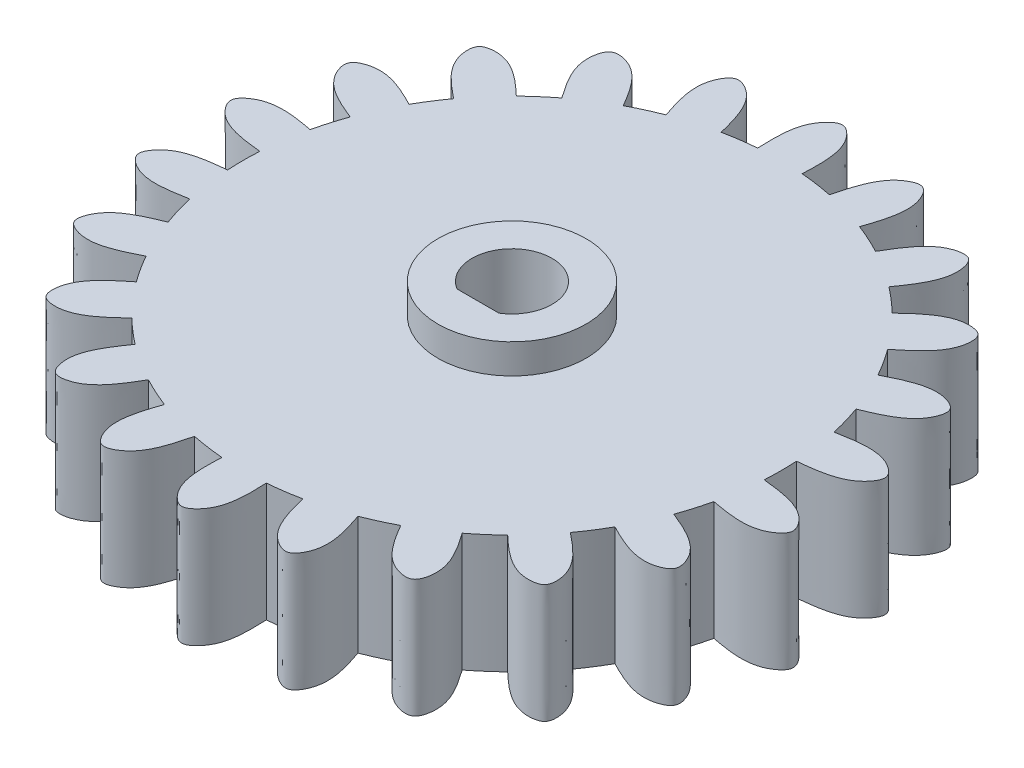
from build123d import *

# Parameters (mm, degrees)
SKETCH1_R           = 18.145
BOSS_EXTRUDE1_DEPTH = 10
SKETCH2_R           = 5
BOSS_EXTRUDE2_DEPTH = 2
BOSS_EXTRUDE5_DEPTH = 10
CIRPATTERN1_COUNT   = 22
CUT_EXTRUDE1_DEPTH  = 34.593002308
SKETCH6_R           = 36.478702283
CUT_EXTRUDE2_DEPTH  = 2


with BuildPart() as part:
    # Sketch1 → Boss-Extrude1 (new body)
    with BuildSketch(Plane(origin=(0, 0, 0), x_dir=(1, 0, 0), z_dir=(0, 1, 0))):
        with Locations(Location((0, 0, 0), (0, 0, 270))):
            Circle(SKETCH1_R)
    extrude(amount=BOSS_EXTRUDE1_DEPTH)

    # Sketch2 → Boss-Extrude2 (add)
    with BuildSketch(Plane(origin=(0, 10, 0), x_dir=(1, 0, 0), z_dir=(0, 1, 0))):
        with Locations(Location((0, 0, 0), (0, 0, 270))):
            Circle(SKETCH2_R)
    extrude(amount=BOSS_EXTRUDE2_DEPTH)

    # Sketch4 → Boss-Extrude5 (add)
    with BuildSketch(Plane.XZ):
        with BuildLine():
            Line((-1.5, -18.082893159), (1.5, -18.082893159))
            add(Edge.make_bspline(
                [(1.5, -18.082893159), (1.52233311, -18.648098407), (1.574363817, -19.964888924), (1.199302648, -21.578369116), (0, -22.486157989), (-1.199302648, -21.578369116), (-1.574363817, -19.964888924), (-1.52233311, -18.648098407), (-1.5, -18.082893159)],
                knots=[0, 0, 0, 0, 0.178316257, 0.415433434, 0.5, 0.584566566, 0.821683743, 1, 1, 1, 1], degree=3))
        make_face()
    boss_extrude5 = extrude(amount=-BOSS_EXTRUDE5_DEPTH)

    # CirPattern1: Boss-Extrude5 ×22 about axis
    cirpattern1_axis = Axis((0, 0, 0), (0, -1, 0))
    for i in range(1, CIRPATTERN1_COUNT):
        add(boss_extrude5.rotate(cirpattern1_axis, i * 360 / CIRPATTERN1_COUNT))

    # Sketch5 → Cut-Extrude1 (cut, through all)
    with BuildSketch(Plane(origin=(0, 12, 0), x_dir=(1, 0, 0), z_dir=(0, 1, 0))):
        with BuildLine():
            Line((1.414213562, -2.3), (-1.414213562, -2.3))
            ThreePointArc((-1.414213562, -2.3), (0, 2.7), (1.414213562, -2.3))
        make_face()
    extrude(amount=-CUT_EXTRUDE1_DEPTH, mode=Mode.SUBTRACT)

    # Sketch6 → Cut-Extrude2 (cut)
    with BuildSketch(Plane.XZ):
        Circle(SKETCH6_R)
    extrude(amount=-CUT_EXTRUDE2_DEPTH, mode=Mode.SUBTRACT)


solid = part.part
